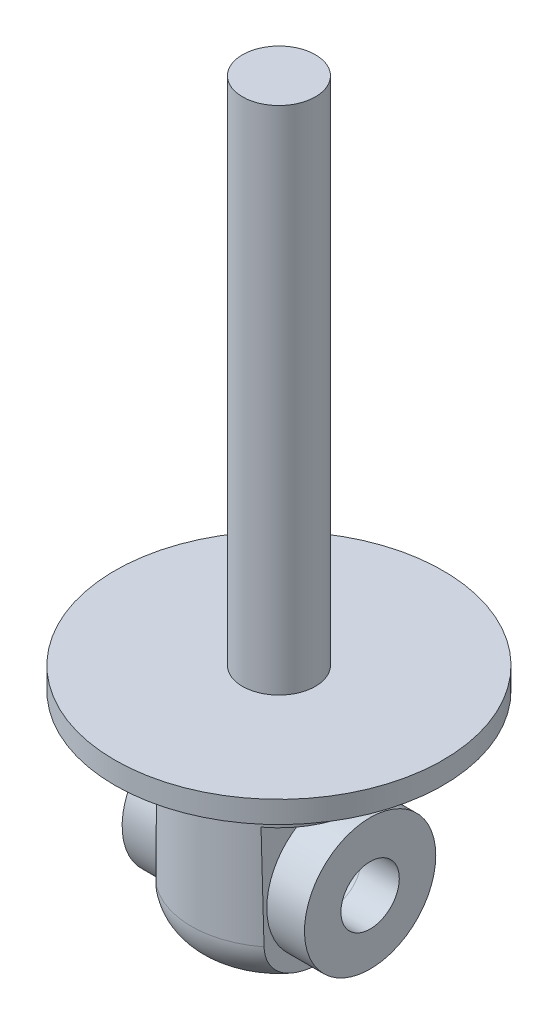
from build123d import *

# Parameters (mm, degrees)
SKETCH1_R               = 22.5
BOSS_EXTRUDE1_DEPTH     = 3
SKETCH2_R               = 5
BOSS_EXTRUDE2_DEPTH     = 70
SKETCH3_R               = 12
BOSS_EXTRUDE3_DEPTH     = 28
FILLET1_R               = 6
CUT_EXTRUDE1_DEPTH      = 80.633535649
CUT_EXTRUDE1_DEPTH_BACK = 80.633535649
SKETCH5_R               = 4
CUT_EXTRUDE4_DEPTH      = 82.796328222
SKETCH13_R              = 9
SKETCH13_RX             = 4.001651582
SKETCH13_RY             = 4
BOSS_EXTRUDE6_DEPTH     = 12.5


with BuildPart() as part:
    # Sketch1 → Boss-Extrude1 (new body)
    with BuildSketch(Plane(origin=(0, 0, 0), x_dir=(1, 0, 0), z_dir=(0, 1, 0))):
        with Locations(Location((0, 0, 0), (0, 0, 270))):
            Circle(SKETCH1_R)
    extrude(amount=BOSS_EXTRUDE1_DEPTH)

    # Sketch2 → Boss-Extrude2 (add)
    with BuildSketch(Plane(origin=(0, 3, 0), x_dir=(1, 0, 0), z_dir=(0, 1, 0))):
        with Locations(Location((0, 0, 0), (0, 0, 270))):
            Circle(SKETCH2_R)
    extrude(amount=BOSS_EXTRUDE2_DEPTH)

    # Sketch3 → Boss-Extrude3 (add)
    with BuildSketch(Plane.XZ):
        with Locations(Location((0, 0, 0), (0, 0, 270))):
            Circle(SKETCH3_R)
    extrude(amount=BOSS_EXTRUDE3_DEPTH)

    # Fillet1
    fillet1_edges = [part.edges().sort_by_distance(p)[0] for p in [
        (0, -28, 12),
    ]]
    fillet(fillet1_edges, radius=FILLET1_R)

    # Sketch4 → Cut-Extrude1 (cut, two sides: drawn at the far end of the back side and taken through both)
    with BuildSketch(Plane.XY.offset(-CUT_EXTRUDE1_DEPTH_BACK)):
        Polygon((7.5, -27.809475019), (29.589181434, -27.809475019), (29.589181434, -7.809475019), (7.168220469, -7.809475019), align=None)
        Polygon((-7.168220469, -7.809475019), (-7.5, -27.809475019), (-29.589181434, -27.809475019), (-29.589181434, -7.809475019), align=None)
    extrude(amount=CUT_EXTRUDE1_DEPTH + CUT_EXTRUDE1_DEPTH_BACK, mode=Mode.SUBTRACT)

    # Sketch5 → Cut-Extrude4 (cut, through all)
    with BuildSketch(Plane(origin=(-7.036732803, 0.116732196, 0), x_dir=(0, 0, 1), z_dir=(-0.9998624313212333, 0.016586694438376407, 0))):
        with Locations(Location((0, -17.930049699, 0), (0, 0, 270))):
            Circle(SKETCH5_R)
    extrude(amount=-CUT_EXTRUDE4_DEPTH, mode=Mode.SUBTRACT)

    # Sketch13 → Boss-Extrude6 (add, symmetric)
    with BuildSketch(Plane(origin=(0, 0, 0), x_dir=(0, 0, -1), z_dir=(1, 0, 0))):
        with Locations(Location((0, -17.820768017, 0), (0, 0, 270))):
            Circle(SKETCH13_R)
        with Locations(Location((0, -18.054249395), (0, 0, 90))):
            Ellipse(SKETCH13_RX, SKETCH13_RY, mode=Mode.SUBTRACT)
    extrude(amount=BOSS_EXTRUDE6_DEPTH, both=True)


solid = part.part
